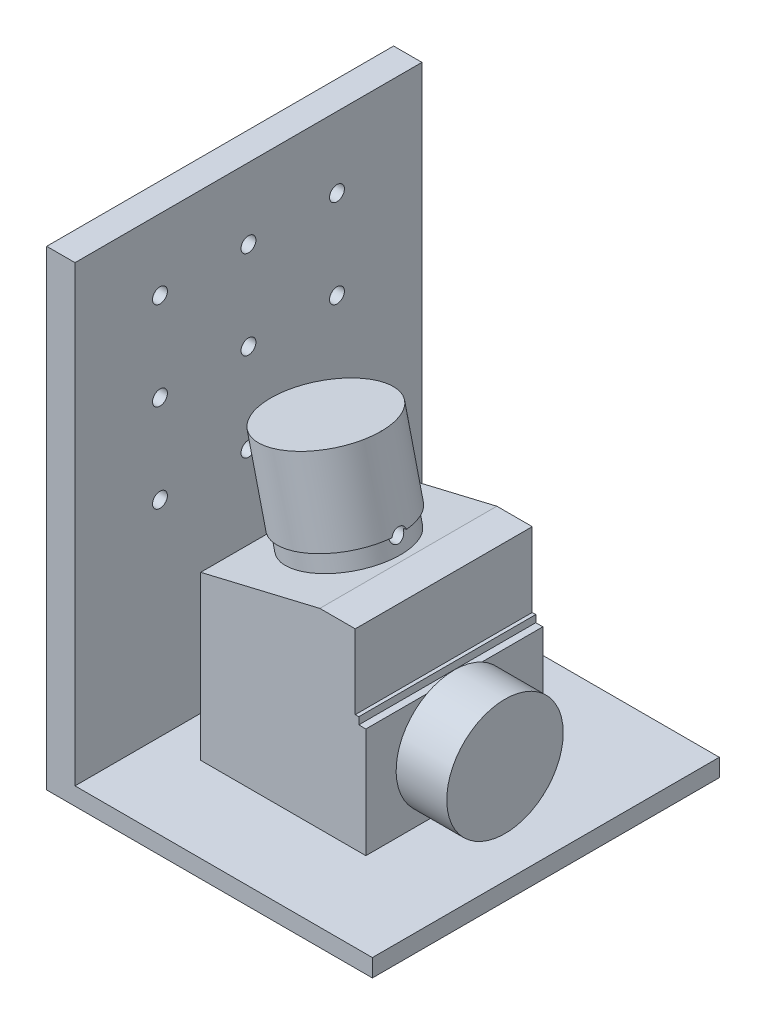
from build123d import *

# Parameters (mm, degrees)
EXTRUDE_1_DEPTH     = 98
EXTRUDE_2_DEPTH     = 25
SKETCH_4_R          = 16.45
EXTRUDE_6_DEPTH     = 14.3
SKETCH_5_R          = 15
EXTRUDE_7_DEPTH     = 5
SKETCH_6_R          = 16
EXTRUDE_8_DEPTH     = 23
SKETCH_7_R          = 5
CUT_EXTRUDE_2_DEPTH = 5
HOLE_WIZARD_M5_1_D  = 4.2


with BuildPart() as part:
    # 草图1 → 凸台-拉伸1 (new body)
    with BuildSketch(Plane.XY):
        Polygon((0, 0), (0, 133), (8, 133), (8, 5), (92, 5), (92, 0), align=None)
    extrude(amount=EXTRUDE_1_DEPTH)



with BuildPart() as body_2:
    # 草图2 → 凸台-拉伸2 (new, symmetric)
    with BuildSketch(Plane.XY.offset(49)):
        Polygon((66.16, 36), (64.16, 36), (64.16, 38), (63.16, 38), (63.16, 59), (53.16, 59), (19.5, 51), (19.5, 5), (66.16, 5), align=None)
    extrude(amount=EXTRUDE_2_DEPTH, both=True)


with BuildPart() as part_1:
    add(part.part)

    add(body_2.part)  # 凸台-拉伸6 merges body 2
    # 草图4 → 凸台-拉伸6 (add)
    with BuildSketch(Plane(origin=(66.16, 0, 0), x_dir=(0, 0, -1), z_dir=(1, 0, 0))):
        with Locations(Location((-49, 21.5, 0), (0, 0, 118.181138406))):
            Circle(SKETCH_4_R)
    extrude(amount=EXTRUDE_6_DEPTH)

    # 草图5 → 凸台-拉伸7 (add)
    with BuildSketch(Plane(origin=(-10.430514532, 43.886389891, 0), x_dir=(0.9728991739264884, 0.23122975019049047, 0), z_dir=(-0.23122975019049047, 0.9728991739264884, 0))):
        with Locations(Location((48.063063249, -49, 0), (0, 0, 180))):
            Circle(SKETCH_5_R)
    extrude(amount=EXTRUDE_7_DEPTH)

    # 草图6 → 凸台-拉伸8 (add)
    with BuildSketch(Plane(origin=(-11.586663283, 48.750885761, 0), x_dir=(0.9728991739264884, 0.2312297501904905, 0), z_dir=(-0.2312297501904905, 0.9728991739264884, 0))):
        with Locations(Location((48.063063249, -49, 0), (0, 0, 180))):
            Circle(SKETCH_6_R)
    extrude(amount=EXTRUDE_8_DEPTH)

    # 草图7 → 切除-拉伸2 (cut)
    with BuildSketch(Plane(origin=(0, 0, 24), x_dir=(-1, 0, 0), z_dir=(0, 0, -1))):
        with Locations((-50.16, 21)):
            Circle(SKETCH_7_R)
    extrude(amount=-CUT_EXTRUDE_2_DEPTH, mode=Mode.SUBTRACT)

    # M5 螺纹孔1 (through all)
    with Locations(Plane.ZY):
        with Locations((24, 63), (49, 63), (74, 63), (74, 88), (49, 88), (24, 88), (24, 113), (49, 113), (74, 113)):
            Hole(HOLE_WIZARD_M5_1_D / 2)


solid = part_1.part
